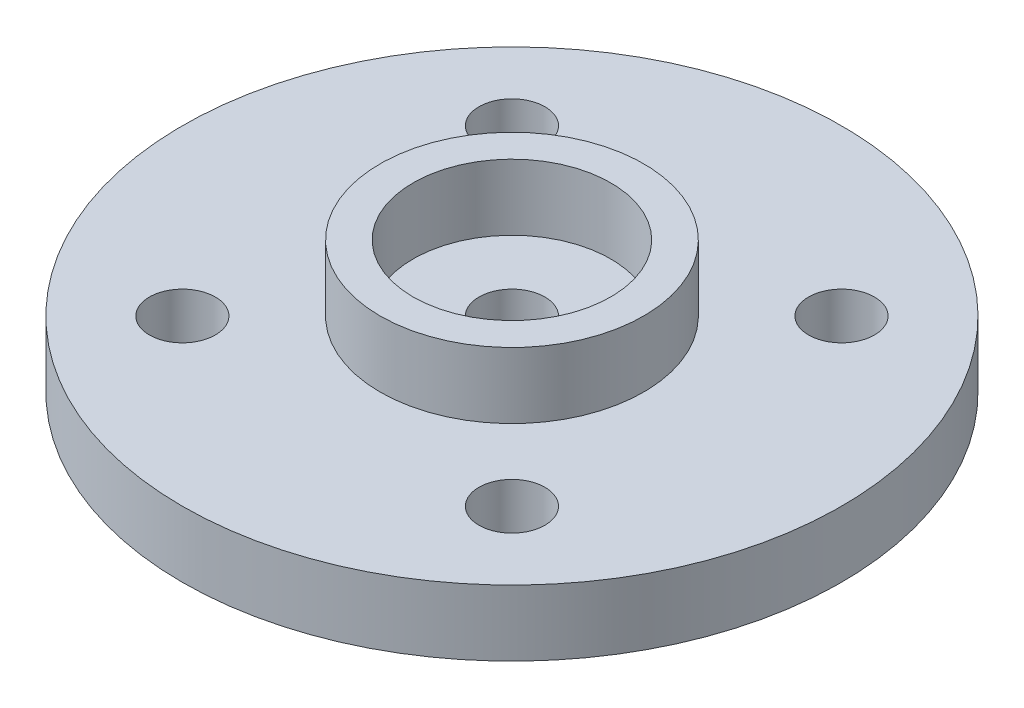
from build123d import *

# Parameters (mm, degrees)
SKETCH_1_R      = 10
SKETCH_1_R_2    = 1
SKETCH_1_R_3    = 3.083795415
EXTRUDE_1_DEPTH = 2
SKETCH_2_R      = 4
SKETCH_2_R_2    = 3
EXTRUDE_2_DEPTH = 2


with BuildPart() as part:
    # 草图1 → 凸台-拉伸1 (new body)
    # profile 1 of 2: a face of its own
    with BuildSketch(Plane(origin=(0, 0, 0), x_dir=(1, 0, 0), z_dir=(0, 1, 0))):
        with Locations(Location((0, 0, 0), (0, 0, 270))):
            Circle(SKETCH_1_R)
        with Locations(Location((-5, -5, 0), (0, 0, 270))):
            Circle(SKETCH_1_R_2, mode=Mode.SUBTRACT)
        with Locations(Location((5, -5, 0), (0, 0, 270))):
            Circle(SKETCH_1_R_2, mode=Mode.SUBTRACT)
        with Locations(Location((5, 5, 0), (0, 0, 270))):
            Circle(SKETCH_1_R_2, mode=Mode.SUBTRACT)
        with Locations(Location((-5, 5, 0), (0, 0, 270))):
            Circle(SKETCH_1_R_2, mode=Mode.SUBTRACT)
        Circle(SKETCH_1_R_3, mode=Mode.SUBTRACT)
    # profile 2 of 2: a face of its own
    with BuildSketch(Plane(origin=(0, 0, 0), x_dir=(1, 0, 0), z_dir=(0, 1, 0))):
        Circle(SKETCH_1_R_3)
        with Locations(Location((0, 0, 0), (0, 0, 270))):
            Circle(SKETCH_1_R_2, mode=Mode.SUBTRACT)
    extrude(amount=EXTRUDE_1_DEPTH)

    # 草图2 → 凸台-拉伸2 (add)
    with BuildSketch(Plane(origin=(0, 2, 0), x_dir=(1, 0, 0), z_dir=(0, 1, 0))):
        with Locations(Location((0, 0, 0), (0, 0, 270))):
            Circle(SKETCH_2_R)
        with Locations(Location((0, 0, 0), (0, 0, 270))):
            Circle(SKETCH_2_R_2, mode=Mode.SUBTRACT)
    extrude(amount=EXTRUDE_2_DEPTH)


solid = part.part
